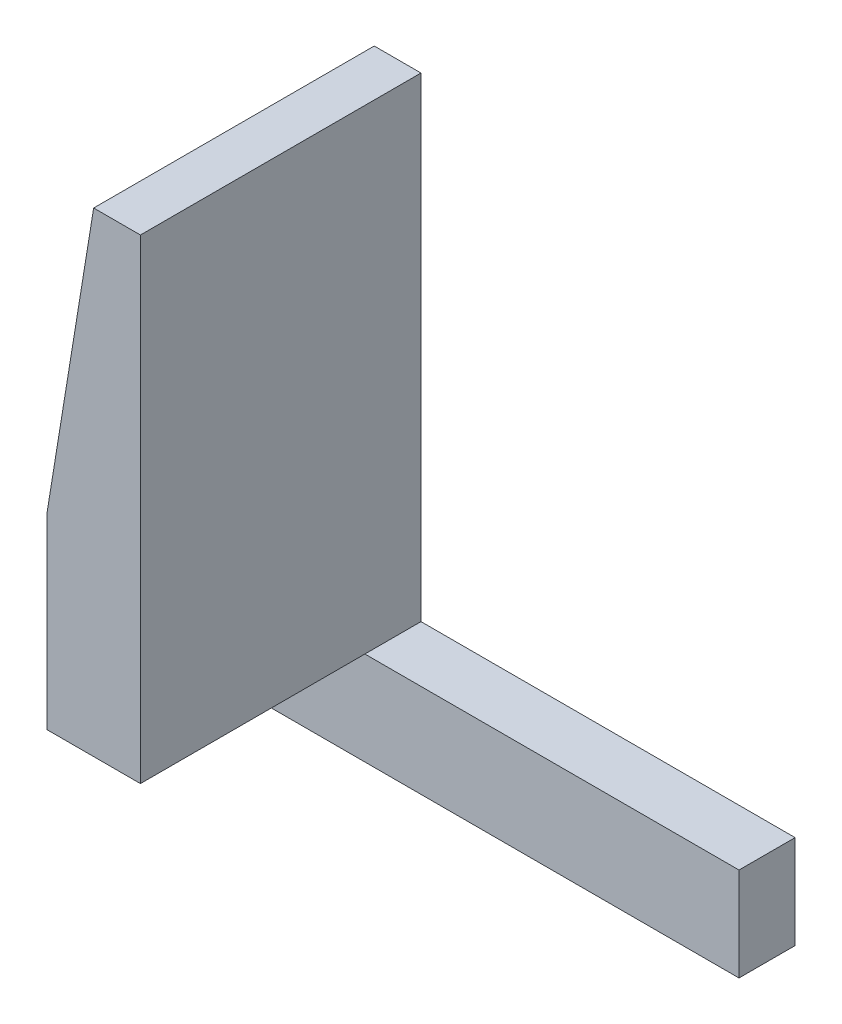
from build123d import *

# Parameters (mm, degrees)
BOSS_EXTRUDE1_DEPTH = 15
SKETCH3_W           = 25
SKETCH3_H           = 3
BOSS_EXTRUDE2_DEPTH = 5


with BuildPart() as part:
    # Sketch2 → Boss-Extrude1 (new body)
    with BuildSketch(Plane.XY):
        Polygon((0, 0), (0, 25.4), (-2.5, 25.4), (-5, 10), (-5, 0), align=None)
    extrude(amount=BOSS_EXTRUDE1_DEPTH)

    # Sketch3 → Boss-Extrude2 (add)
    with BuildSketch(Plane.XZ):
        with Locations((7.5, 1.5)):
            Rectangle(SKETCH3_W, SKETCH3_H)
    extrude(amount=BOSS_EXTRUDE2_DEPTH)


solid = part.part
